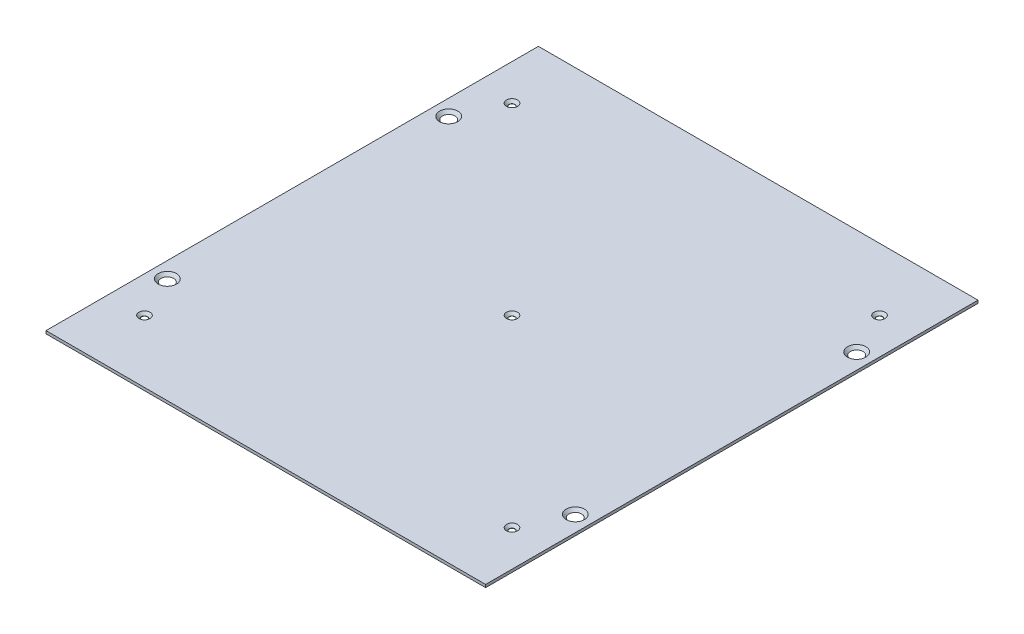
from build123d import *

# Parameters (mm, degrees)
SKETCH1_W                                      = 250
SKETCH1_H                                      = 280
BOSS_EXTRUDE1_DEPTH                            = 1.6
CSK_FOR_M5_FLAT_HEAD_MACHINE_SCREW1_AT_2_COUNT = 2
CSK_FOR_M5_FLAT_HEAD_MACHINE_SCREW1_AT_2_PITCH = 232
CSK_FOR_M5_FLAT_HEAD_MACHINE_SCREW1_AT_3_COUNT = 2
CSK_FOR_M5_FLAT_HEAD_MACHINE_SCREW1_AT_3_PITCH = 281.822639261
CSK_FOR_M5_FLAT_HEAD_MACHINE_SCREW1_AT_4_COUNT = 2
CSK_FOR_M5_FLAT_HEAD_MACHINE_SCREW1_AT_4_PITCH = 160
CSK_FOR_M3_FLAT_HEAD_MACHINE_SCREW1_AT_2_COUNT = 2
CSK_FOR_M3_FLAT_HEAD_MACHINE_SCREW1_AT_2_PITCH = 147.785317268
CSK_FOR_M3_FLAT_HEAD_MACHINE_SCREW1_AT_3_COUNT = 2
CSK_FOR_M3_FLAT_HEAD_MACHINE_SCREW1_AT_3_PITCH = 147.785317268
CSK_FOR_M3_FLAT_HEAD_MACHINE_SCREW1_AT_4_COUNT = 2
CSK_FOR_M3_FLAT_HEAD_MACHINE_SCREW1_AT_4_PITCH = 147.785317268
CSK_FOR_M3_FLAT_HEAD_MACHINE_SCREW1_AT_5_COUNT = 2
CSK_FOR_M3_FLAT_HEAD_MACHINE_SCREW1_AT_5_PITCH = 147.785317268


with BuildPart() as part:
    # Sketch1 → Boss-Extrude1 (new body)
    with BuildSketch(Plane(origin=(0, 0, 0), x_dir=(1, 0, 0), z_dir=(0, 1, 0))):
        Rectangle(SKETCH1_W, SKETCH1_H)
    extrude(amount=BOSS_EXTRUDE1_DEPTH)

    # Sketch2 → CSK for M5 Flat Head Machine Screw1 (revolve, cut)
    with BuildSketch(Plane(origin=(-116, 1.6, -80), x_dir=(0, 0, 1), z_dir=(1, 0, 0))):
        Polygon((0, 0), (0, 1.6), (2.75, 1.6), (2.75, 2.45), (5.2, 0), align=None)
    csk_for_m5_flat_head_machine_screw1 = revolve(axis=Axis((-116, 7.95, -80), (0, -1, 0)), mode=Mode.SUBTRACT)

    # CSK for M5 Flat Head Machine Screw1 at 2: CSK for M5 Flat Head Machine Screw1 ×2
    with Locations(*[(i * CSK_FOR_M5_FLAT_HEAD_MACHINE_SCREW1_AT_2_PITCH, 0, 0) for i in range(1, CSK_FOR_M5_FLAT_HEAD_MACHINE_SCREW1_AT_2_COUNT)]):
        add(csk_for_m5_flat_head_machine_screw1, mode=Mode.SUBTRACT)

    # CSK for M5 Flat Head Machine Screw1 at 3: CSK for M5 Flat Head Machine Screw1 ×2
    with Locations(*[Vector(0.8232127859153064, 0, 0.5677329558036596) * (i * CSK_FOR_M5_FLAT_HEAD_MACHINE_SCREW1_AT_3_PITCH) for i in range(1, CSK_FOR_M5_FLAT_HEAD_MACHINE_SCREW1_AT_3_COUNT)]):
        add(csk_for_m5_flat_head_machine_screw1, mode=Mode.SUBTRACT)

    # CSK for M5 Flat Head Machine Screw1 at 4: CSK for M5 Flat Head Machine Screw1 ×2
    with Locations(*[(0, 0, i * CSK_FOR_M5_FLAT_HEAD_MACHINE_SCREW1_AT_4_PITCH) for i in range(1, CSK_FOR_M5_FLAT_HEAD_MACHINE_SCREW1_AT_4_COUNT)]):
        add(csk_for_m5_flat_head_machine_screw1, mode=Mode.SUBTRACT)

    # Sketch4 → CSK for M3 Flat Head Machine Screw1 (revolve, cut)
    with BuildSketch(Plane(origin=(0, 1.6, 0), x_dir=(0, 0, 1), z_dir=(1, 0, 0))):
        Polygon((0, 0), (0, 1.6), (1.7, 1.6), (1.7, 1.45), (3.15, 0), align=None)
    csk_for_m3_flat_head_machine_screw1 = revolve(axis=Axis((0, 7.95, 0), (0, -1, 0)), mode=Mode.SUBTRACT)

    # CSK for M3 Flat Head Machine Screw1 at 2: CSK for M3 Flat Head Machine Screw1 ×2
    with Locations(*[Vector(-0.7071067811865471, 0, 0.7071067811865479) * (i * CSK_FOR_M3_FLAT_HEAD_MACHINE_SCREW1_AT_2_PITCH) for i in range(1, CSK_FOR_M3_FLAT_HEAD_MACHINE_SCREW1_AT_2_COUNT)]):
        add(csk_for_m3_flat_head_machine_screw1, mode=Mode.SUBTRACT)

    # CSK for M3 Flat Head Machine Screw1 at 3: CSK for M3 Flat Head Machine Screw1 ×2
    with Locations(*[Vector(0.7071067811865477, 0, 0.7071067811865474) * (i * CSK_FOR_M3_FLAT_HEAD_MACHINE_SCREW1_AT_3_PITCH) for i in range(1, CSK_FOR_M3_FLAT_HEAD_MACHINE_SCREW1_AT_3_COUNT)]):
        add(csk_for_m3_flat_head_machine_screw1, mode=Mode.SUBTRACT)

    # CSK for M3 Flat Head Machine Screw1 at 4: CSK for M3 Flat Head Machine Screw1 ×2
    with Locations(*[Vector(0.7071067811865477, 0, -0.7071067811865475) * (i * CSK_FOR_M3_FLAT_HEAD_MACHINE_SCREW1_AT_4_PITCH) for i in range(1, CSK_FOR_M3_FLAT_HEAD_MACHINE_SCREW1_AT_4_COUNT)]):
        add(csk_for_m3_flat_head_machine_screw1, mode=Mode.SUBTRACT)

    # CSK for M3 Flat Head Machine Screw1 at 5: CSK for M3 Flat Head Machine Screw1 ×2
    with Locations(*[Vector(-0.7071067811865478, 0, -0.7071067811865474) * (i * CSK_FOR_M3_FLAT_HEAD_MACHINE_SCREW1_AT_5_PITCH) for i in range(1, CSK_FOR_M3_FLAT_HEAD_MACHINE_SCREW1_AT_5_COUNT)]):
        add(csk_for_m3_flat_head_machine_screw1, mode=Mode.SUBTRACT)


solid = part.part
